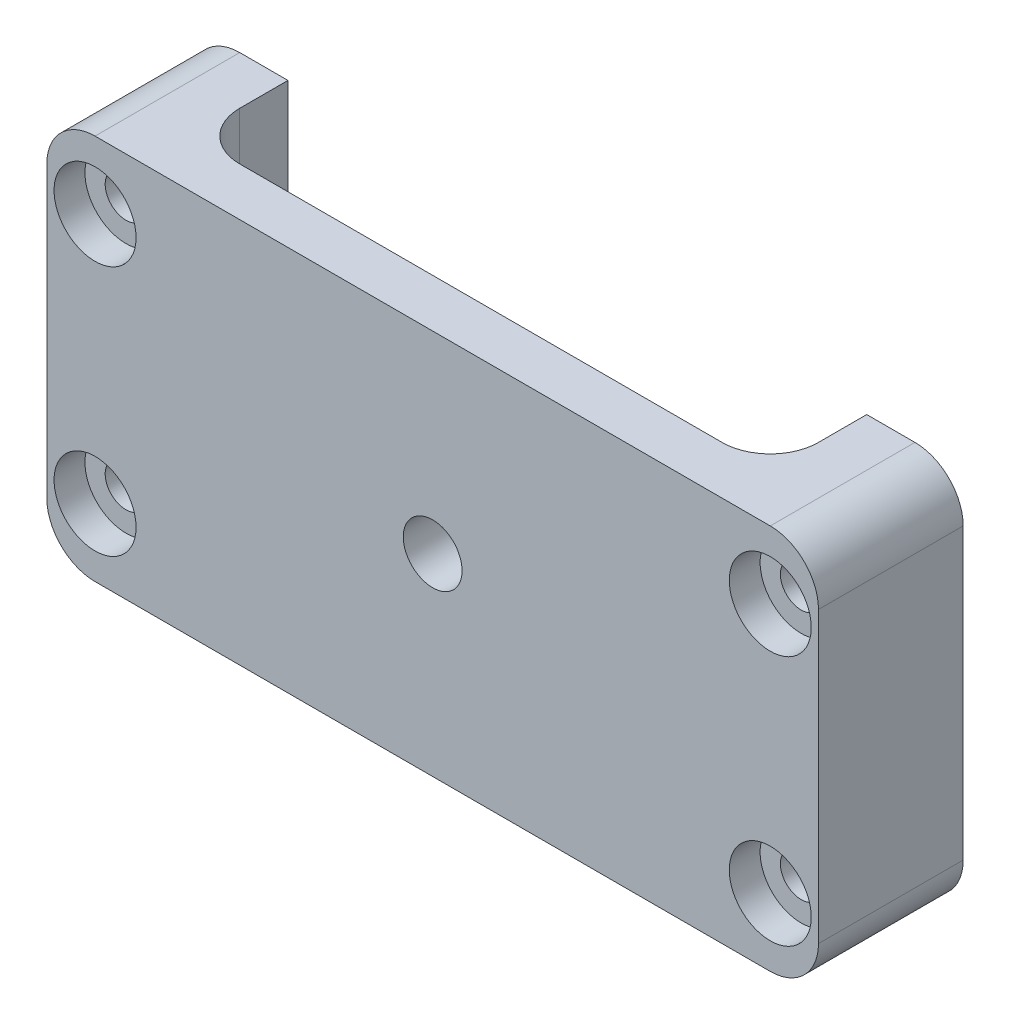
from build123d import *

# Parameters (mm, degrees)
SKETCH1_W                                        = 40
SKETCH1_H                                        = 40
BOSS_EXTRUDE1_DEPTH                              = 15
SKETCH2_W                                        = 30
SKETCH2_H                                        = 10
CUT_EXTRUDE1_DEPTH                               = 59.523499554
FILLET1_R                                        = 5
FILLET2_R                                        = 5
CBORE_FOR_M4_PAN_HEAD_MACHINE_SCREW1_D           = 4.3
CBORE_FOR_M4_PAN_HEAD_MACHINE_SCREW1_CBORE_D     = 8.5
CBORE_FOR_M4_PAN_HEAD_MACHINE_SCREW1_CBORE_DEPTH = 3.2
FILLET1_OF_MIRROR1_R                             = 5
FILLET2_OF_MIRROR1_R                             = 5
SKETCH4_R                                        = 3.048
CUT_EXTRUDE2_DEPTH                               = 59.523499554


with BuildPart() as part:
    # Sketch1 → Boss-Extrude1 (new body)
    with BuildSketch(Plane.XY):
        with Locations((20, 20)):
            Rectangle(SKETCH1_W, SKETCH1_H)
    boss_extrude1 = extrude(amount=BOSS_EXTRUDE1_DEPTH)

    # Sketch2 → Cut-Extrude1 (cut, through all)
    with BuildSketch(Plane.XZ):
        with Locations((15, 5)):
            Rectangle(SKETCH2_W, SKETCH2_H)
    cut_extrude1 = extrude(amount=-CUT_EXTRUDE1_DEPTH, mode=Mode.SUBTRACT)

    # Fillet1
    fillet1_edges = [part.edges().sort_by_distance(p)[0] for p in [
        (30, 20, 10),
    ]]
    fillet(fillet1_edges, radius=FILLET1_R)

    # Fillet2
    fillet2_edges = [part.edges().sort_by_distance(p)[0] for p in [
        (40, 40, 7.5),
        (40, 0, 7.5),
    ]]
    fillet(fillet2_edges, radius=FILLET2_R)

    # CBORE for M4 Pan Head Machine Screw1 (through all)
    with Locations(Plane(origin=(35, 33, 15), x_dir=(1, 0, 0), z_dir=(0, 0, 1))):
        with Locations((0, 0), (0, -26)):
            cbore_for_m4_pan_head_machine_screw1 = CounterBoreHole(CBORE_FOR_M4_PAN_HEAD_MACHINE_SCREW1_D / 2, CBORE_FOR_M4_PAN_HEAD_MACHINE_SCREW1_CBORE_D / 2, CBORE_FOR_M4_PAN_HEAD_MACHINE_SCREW1_CBORE_DEPTH)

    # Mirror1: Boss-Extrude1, Cut-Extrude1, CBORE for M4 Pan Head Machine Screw1 across plane
    add(boss_extrude1.mirror(Plane(origin=(0, 0, 15), x_dir=(0, 0, 1), z_dir=(1, 0, 0))))
    add(cut_extrude1.mirror(Plane(origin=(0, 0, 15), x_dir=(0, 0, 1), z_dir=(1, 0, 0))), mode=Mode.SUBTRACT)
    add(cbore_for_m4_pan_head_machine_screw1.mirror(Plane(origin=(0, 0, 15), x_dir=(0, 0, 1), z_dir=(1, 0, 0))), mode=Mode.SUBTRACT)

    # Fillet1 of Mirror1
    fillet1_of_mirror1_edges = [part.edges().sort_by_distance(p)[0] for p in [
        (-30, 20, 10),
    ]]
    fillet(fillet1_of_mirror1_edges, radius=FILLET1_OF_MIRROR1_R)

    # Fillet2 of Mirror1
    fillet2_of_mirror1_edges = [part.edges().sort_by_distance(p)[0] for p in [
        (-40, 40, 7.5),
        (-40, 0, 7.5),
    ]]
    fillet(fillet2_of_mirror1_edges, radius=FILLET2_OF_MIRROR1_R)

    # Sketch4 → Cut-Extrude2 (cut, through all)
    with BuildSketch(Plane.XY.offset(15)):
        with Locations((0, 20)):
            Circle(SKETCH4_R)
    extrude(amount=-CUT_EXTRUDE2_DEPTH, mode=Mode.SUBTRACT)


solid = part.part
